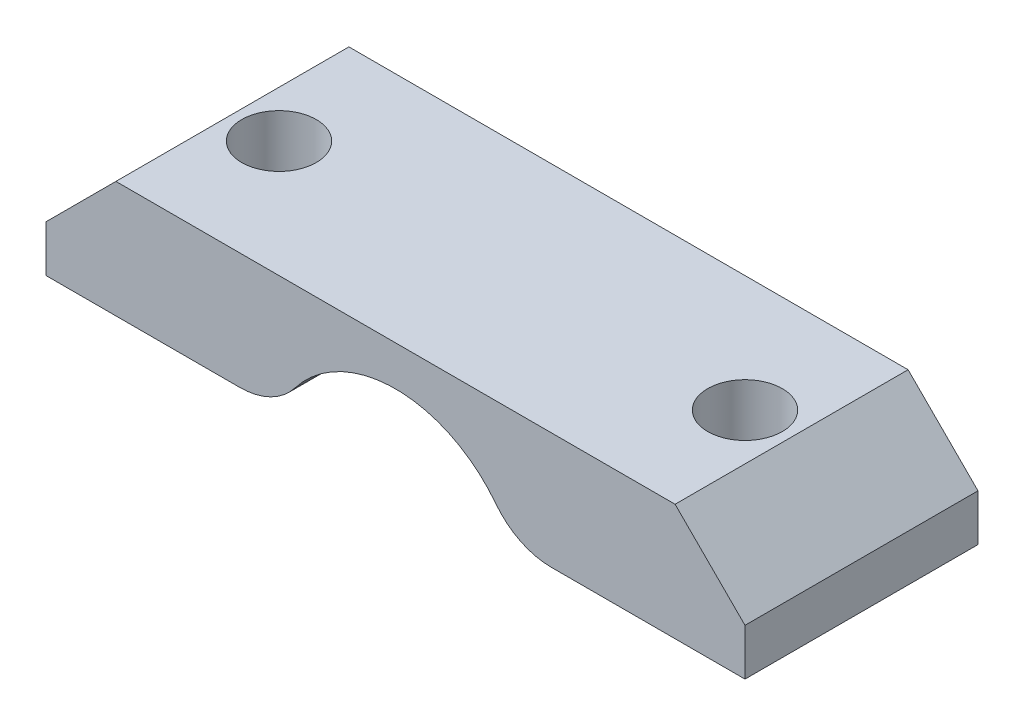
from build123d import *

# Parameters (mm, degrees)
AUFSATZ_LINEAR_AUSTRAGEN1_DEPTH = 10
SKIZZE4_R                       = 1.6
SCHNITT_LINEAR_AUSTRAGEN1_DEPTH = 10
FASE1_SIZE                      = 3
VERRUNDUNG1_R                   = 3


with BuildPart() as part:
    # Skizze3 → Aufsatz-Linear austragen1 (new body)
    with BuildSketch(Plane.XY):
        with BuildLine():
            Line((0, 0), (0, 5))
            Line((0, 5), (30, 5))
            Line((30, 5), (30, 0))
            Line((30, 0), (20, 0))
            ThreePointArc((20, 0), (15, 3.289673338), (10, 0))
            Line((10, 0), (0, 0))
        make_face()
    extrude(amount=AUFSATZ_LINEAR_AUSTRAGEN1_DEPTH)

    # Skizze4 → Schnitt-Linear austragen1 (cut)
    with BuildSketch(Plane(origin=(0, 5, 0), x_dir=(1, 0, 0), z_dir=(0, 1, 0))):
        with Locations(Location((5, -5, 0), (0, 0, 270))):
            Circle(SKIZZE4_R)
        with Locations(Location((25, -5, 0), (0, 0, 270))):
            Circle(SKIZZE4_R)
    extrude(amount=-SCHNITT_LINEAR_AUSTRAGEN1_DEPTH, mode=Mode.SUBTRACT)

    # Fase1
    fase1_edges = [part.edges().sort_by_distance(p)[0] for p in [
        (0, 5, 5),
        (30, 5, 5),
    ]]
    chamfer(fase1_edges, length=FASE1_SIZE)

    # Verrundung1
    verrundung1_edges = [part.edges().sort_by_distance(p)[0] for p in [
        (20, 0, 5),
        (10, 0, 5),
    ]]
    fillet(verrundung1_edges, radius=VERRUNDUNG1_R)


solid = part.part
